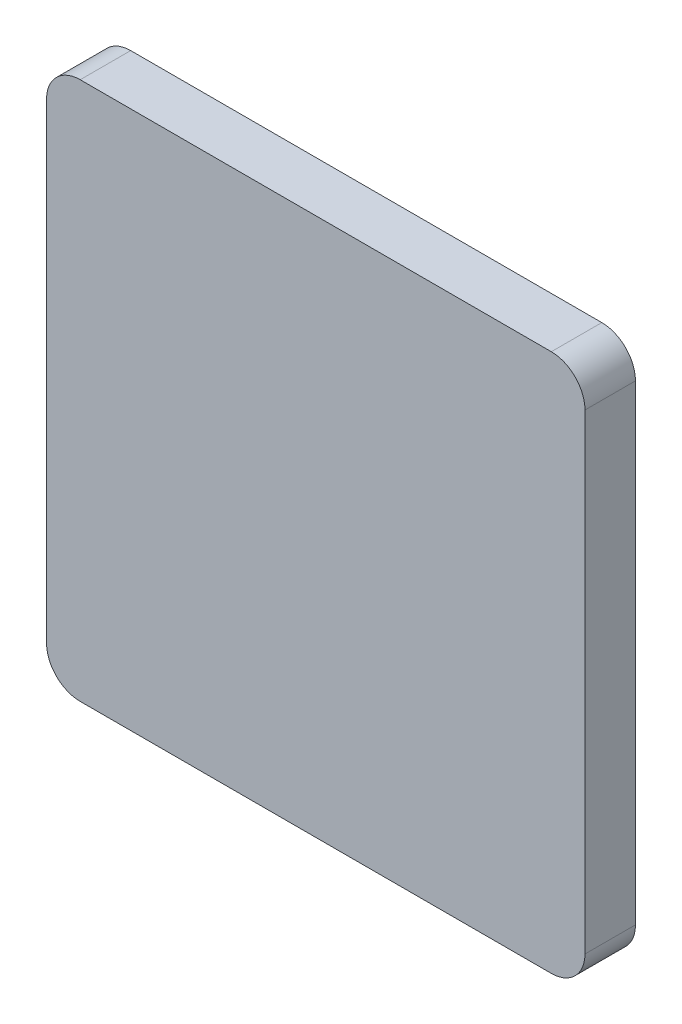
from build123d import *

# Parameters (mm, degrees)
CROQUIS1_W              = 32
CROQUIS1_H              = 32
SALIENTE_EXTRUIR1_DEPTH = 3
REDONDEO1_R             = 2


with BuildPart() as part:
    # Croquis1 → Saliente-Extruir1 (new body)
    with BuildSketch(Plane.XY):
        Rectangle(CROQUIS1_W, CROQUIS1_H)
    extrude(amount=SALIENTE_EXTRUIR1_DEPTH)

    # Redondeo1
    redondeo1_edges = [part.edges().sort_by_distance(p)[0] for p in [
        (16, -16, 1.5),
        (-16, -16, 1.5),
        (-16, 16, 1.5),
        (16, 16, 1.5),
    ]]
    fillet(redondeo1_edges, radius=REDONDEO1_R)


solid = part.part
